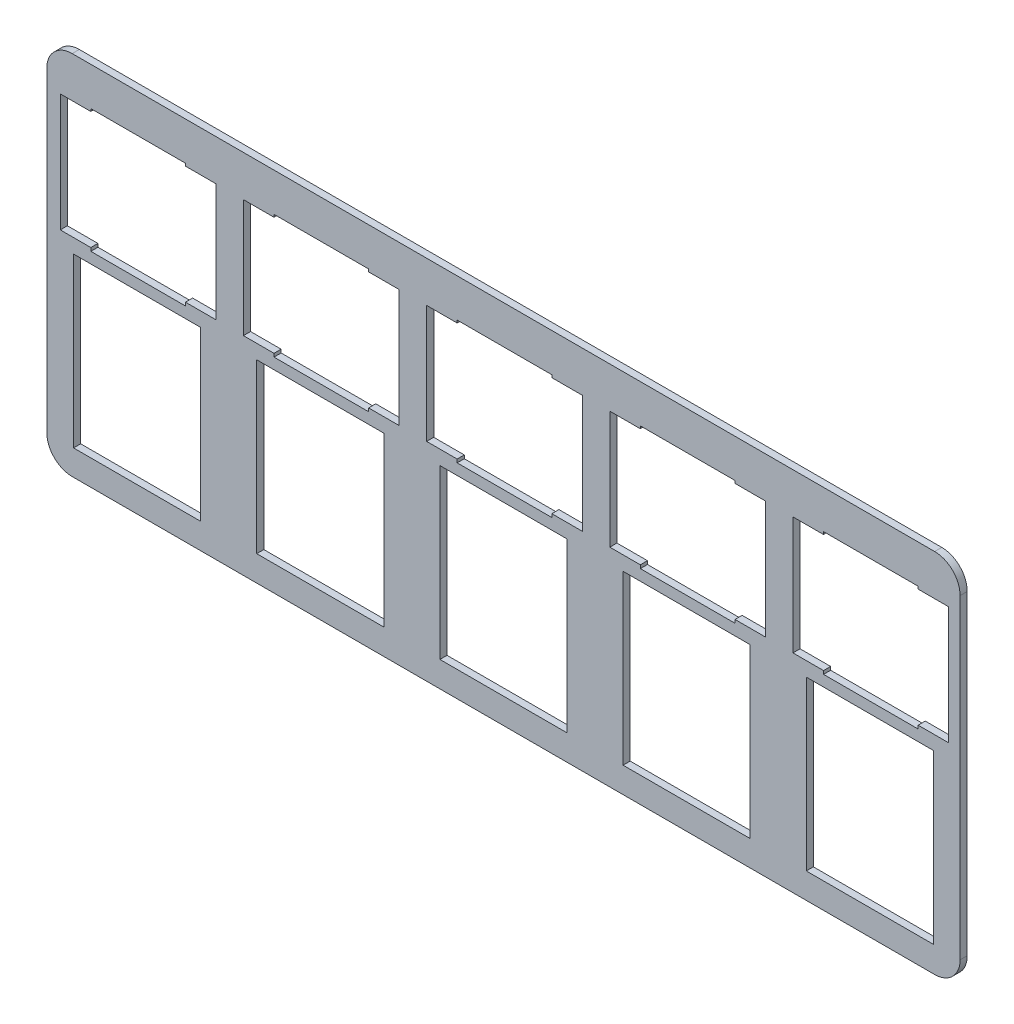
from build123d import *

# Parameters (mm, degrees)
SKIZZE1_W                       = 179.5
SKIZZE1_H                       = 72
AUFSATZ_LINEAR_AUSTRAGEN1_DEPTH = 1.4
VERRUNDUNG1_R                   = 5
SKIZZE2_W                       = 24.97465075
SKIZZE2_H                       = 33
SCHNITT_LINEAR_AUSTRAGEN1_DEPTH = 97.711025742
SCHNITT_LINEAR_AUSTRAGEN2_DEPTH = 97.711025742
LINEARES_MUSTER1_COUNT          = 5
LINEARES_MUSTER1_PITCH          = 36


with BuildPart() as part:
    # Skizze1 → Aufsatz-Linear austragen1 (new body)
    with BuildSketch(Plane.XY):
        Rectangle(SKIZZE1_W, SKIZZE1_H)
    extrude(amount=AUFSATZ_LINEAR_AUSTRAGEN1_DEPTH)

    # Verrundung1
    verrundung1_edges = [part.edges().sort_by_distance(p)[0] for p in [
        (89.75, -36, 0.7),
        (-89.75, -36, 0.7),
        (-89.75, 36, 0.7),
        (89.75, 36, 0.7),
    ]]
    fillet(verrundung1_edges, radius=VERRUNDUNG1_R)

    # Skizze2 → Schnitt-Linear austragen1 (cut, through all)
    with BuildSketch(Plane.XY.offset(1.4)):
        with Locations((72, -14.487360935)):
            Rectangle(SKIZZE2_W, SKIZZE2_H)
    schnitt_linear_austragen1 = extrude(amount=-SCHNITT_LINEAR_AUSTRAGEN1_DEPTH, mode=Mode.SUBTRACT)

    # Skizze3 → Schnitt-Linear austragen2 (cut, through all)
    with BuildSketch(Plane.XY.offset(1.4)):
        Polygon((62.905000508, 28.468009652), (81.505000508, 28.468009652), (81.505000508, 27.968009652), (87.505000508, 27.968009652), (87.505000508, 4.818009652), (81.505000508, 4.818009652), (81.505000508, 4.168009652), (62.905000508, 4.168009652), (62.905000508, 4.818009652), (56.905000508, 4.818009652), (56.905000508, 27.968009652), (62.905000508, 27.968009652), align=None)
    schnitt_linear_austragen2 = extrude(amount=-SCHNITT_LINEAR_AUSTRAGEN2_DEPTH, mode=Mode.SUBTRACT)

    # Lineares Muster1: Schnitt-Linear austragen1, Schnitt-Linear austragen2 ×5
    with Locations(*[(-i * LINEARES_MUSTER1_PITCH, 0, 0) for i in range(1, LINEARES_MUSTER1_COUNT)]):
        add(schnitt_linear_austragen1, mode=Mode.SUBTRACT)
        add(schnitt_linear_austragen2, mode=Mode.SUBTRACT)


solid = part.part
